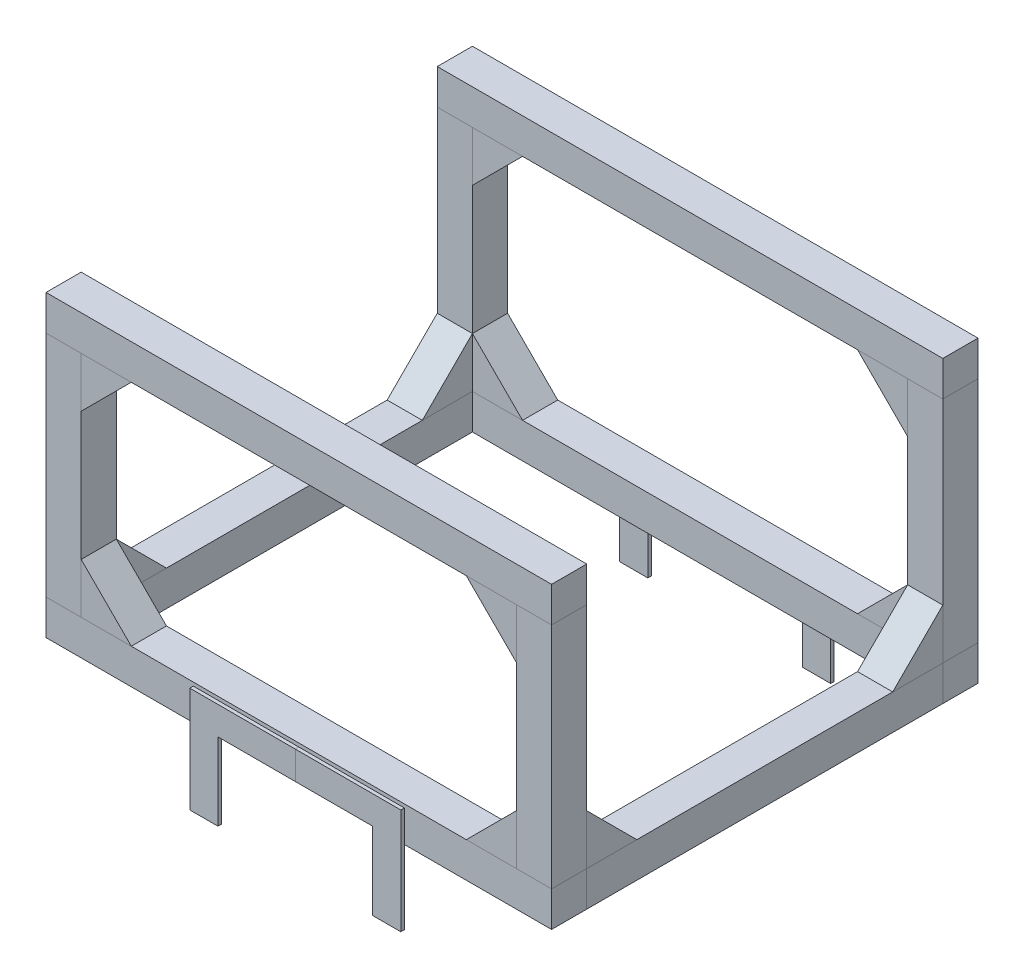
from build123d import *

# Parameters (mm, degrees)
SKETCH1_W             = 20
SKETCH1_H             = 20
BOSS_EXTRUDE1_DEPTH   = 101.25
BOSS_EXTRUDE1_2_DEPTH = 101.25
SKETCH2_W             = 20
SKETCH2_H             = 20
BOSS_EXTRUDE2_DEPTH   = 287.5
BOSS_EXTRUDE2_2_DEPTH = 287.5
SKETCH4_W             = 20
SKETCH4_H             = 20
BOSS_EXTRUDE3_DEPTH   = 130
BOSS_EXTRUDE3_2_DEPTH = 130
BOSS_EXTRUDE3_3_DEPTH = 130
BOSS_EXTRUDE3_4_DEPTH = 130
SKETCH5_W             = 20
SKETCH5_H             = 20
BOSS_EXTRUDE4_DEPTH   = 287.5
BOSS_EXTRUDE4_2_DEPTH = 287.5
BOSS_EXTRUDE5_DEPTH   = 20
BOSS_EXTRUDE5_2_DEPTH = 20
BOSS_EXTRUDE6_DEPTH   = 20
BOSS_EXTRUDE6_2_DEPTH = 20
BOSS_EXTRUDE7_DEPTH   = 20
BOSS_EXTRUDE7_2_DEPTH = 20
BOSS_EXTRUDE7_3_DEPTH = 20
BOSS_EXTRUDE7_4_DEPTH = 20
BOSS_EXTRUDE8_DEPTH   = 20
BOSS_EXTRUDE8_2_DEPTH = 20
BOSS_EXTRUDE8_3_DEPTH = 20
BOSS_EXTRUDE8_4_DEPTH = 20
BOSS_EXTRUDE9_DEPTH   = 2
BOSS_EXTRUDE10_DEPTH  = 2
BOSS_EXTRUDE11_DEPTH  = 2
BOSS_EXTRUDE12_DEPTH  = 2


with BuildPart() as part:
    # Sketch1 → Boss-Extrude1 (new, symmetric)
    with BuildSketch(Plane.XY):
        Rectangle(SKETCH1_W, SKETCH1_H)
    extrude(amount=BOSS_EXTRUDE1_DEPTH, both=True)


with BuildPart() as body_2:
    # Sketch1 → Boss-Extrude1 2 (new, symmetric)
    with BuildSketch(Plane.XY):
        with Locations((267.5, 0)):
            Rectangle(SKETCH1_W, SKETCH1_H)
    extrude(amount=BOSS_EXTRUDE1_2_DEPTH, both=True)


with BuildPart() as body_3:
    # Sketch2 → Boss-Extrude2 (new body)
    with BuildSketch(Plane.ZY.offset(10)):
        with Locations((111.25, 0)):
            Rectangle(SKETCH2_W, SKETCH2_H)
    extrude(amount=-BOSS_EXTRUDE2_DEPTH)


with BuildPart() as body_4:
    # Sketch2 → Boss-Extrude2 2 (new body)
    with BuildSketch(Plane.ZY.offset(10)):
        with Locations((-111.25, 0)):
            Rectangle(SKETCH2_W, SKETCH2_H)
    extrude(amount=-BOSS_EXTRUDE2_2_DEPTH)


with BuildPart() as body_5:
    # Sketch4 → Boss-Extrude3 (new body)
    with BuildSketch(Plane(origin=(0, 10, 0), x_dir=(1, 0, 0), z_dir=(0, 1, 0))):
        with Locations((0, 111.25)):
            Rectangle(SKETCH4_W, SKETCH4_H)
    extrude(amount=BOSS_EXTRUDE3_DEPTH)


with BuildPart() as body_6:
    # Sketch4 → Boss-Extrude3 2 (new body)
    with BuildSketch(Plane(origin=(0, 10, 0), x_dir=(1, 0, 0), z_dir=(0, 1, 0))):
        with Locations((0, -111.25)):
            Rectangle(SKETCH4_W, SKETCH4_H)
    extrude(amount=BOSS_EXTRUDE3_2_DEPTH)


with BuildPart() as body_7:
    # Sketch4 → Boss-Extrude3 3 (new body)
    with BuildSketch(Plane(origin=(0, 10, 0), x_dir=(1, 0, 0), z_dir=(0, 1, 0))):
        with Locations((267.5, -111.25)):
            Rectangle(SKETCH4_W, SKETCH4_H)
    extrude(amount=BOSS_EXTRUDE3_3_DEPTH)


with BuildPart() as body_8:
    # Sketch4 → Boss-Extrude3 4 (new body)
    with BuildSketch(Plane(origin=(0, 10, 0), x_dir=(1, 0, 0), z_dir=(0, 1, 0))):
        with Locations((267.5, 111.25)):
            Rectangle(SKETCH4_W, SKETCH4_H)
    extrude(amount=BOSS_EXTRUDE3_4_DEPTH)


with BuildPart() as body_9:
    # Sketch5 → Boss-Extrude4 (new body)
    with BuildSketch(Plane.ZY.offset(10)):
        with Locations((-111.25, 150)):
            Rectangle(SKETCH5_W, SKETCH5_H)
    extrude(amount=-BOSS_EXTRUDE4_DEPTH)


with BuildPart() as body_10:
    # Sketch5 → Boss-Extrude4 2 (new body)
    with BuildSketch(Plane.ZY.offset(10)):
        with Locations((111.25, 150)):
            Rectangle(SKETCH5_W, SKETCH5_H)
    extrude(amount=-BOSS_EXTRUDE4_2_DEPTH)


with BuildPart() as body_11:
    # Sketch6 → Boss-Extrude5 (new body)
    with BuildSketch(Plane(origin=(277.5, 0, 0), x_dir=(0, 0, -1), z_dir=(1, 0, 0))):
        Polygon((-101.25, 10), (-72.75, 10), (-101.25, 38.5), align=None)
    extrude(amount=-BOSS_EXTRUDE5_DEPTH)


with BuildPart() as body_12:
    # Sketch6 → Boss-Extrude5 2 (new body)
    with BuildSketch(Plane(origin=(277.5, 0, 0), x_dir=(0, 0, -1), z_dir=(1, 0, 0))):
        Polygon((101.25, 10), (72.75, 10), (101.25, 38.5), align=None)
    extrude(amount=-BOSS_EXTRUDE5_2_DEPTH)


with BuildPart() as body_13:
    # Sketch7 → Boss-Extrude6 (new body)
    with BuildSketch(Plane.ZY.offset(10)):
        Polygon((-101.25, 10), (-101.25, 38.5), (-72.75, 10), align=None)
    extrude(amount=-BOSS_EXTRUDE6_DEPTH)


with BuildPart() as body_14:
    # Sketch7 → Boss-Extrude6 2 (new body)
    with BuildSketch(Plane.ZY.offset(10)):
        Polygon((101.25, 10), (101.25, 38.5), (72.75, 10), align=None)
    extrude(amount=-BOSS_EXTRUDE6_2_DEPTH)


with BuildPart() as body_15:
    # Sketch8 → Boss-Extrude7 (new body)
    with BuildSketch(Plane.XY.offset(121.25)):
        Polygon((10, 10), (10, 38.5), (38.5, 10), align=None)
    extrude(amount=-BOSS_EXTRUDE7_DEPTH)


with BuildPart() as body_16:
    # Sketch8 → Boss-Extrude7 2 (new body)
    with BuildSketch(Plane.XY.offset(121.25)):
        Polygon((10, 140), (10, 111.5), (38.5, 140), align=None)
    extrude(amount=-BOSS_EXTRUDE7_2_DEPTH)


with BuildPart() as body_17:
    # Sketch8 → Boss-Extrude7 3 (new body)
    with BuildSketch(Plane.XY.offset(121.25)):
        Polygon((257.5, 140), (257.5, 111.5), (229, 140), align=None)
    extrude(amount=-BOSS_EXTRUDE7_3_DEPTH)


with BuildPart() as body_18:
    # Sketch8 → Boss-Extrude7 4 (new body)
    with BuildSketch(Plane.XY.offset(121.25)):
        Polygon((257.5, 10), (257.5, 38.5), (229, 10), align=None)
    extrude(amount=-BOSS_EXTRUDE7_4_DEPTH)


with BuildPart() as body_19:
    # Sketch9 → Boss-Extrude8 (new body)
    with BuildSketch(Plane(origin=(0, 0, -121.25), x_dir=(-1, 0, 0), z_dir=(0, 0, -1))):
        Polygon((-229, 10), (-257.5, 10), (-257.5, 38.5), align=None)
    extrude(amount=-BOSS_EXTRUDE8_DEPTH)


with BuildPart() as body_20:
    # Sketch9 → Boss-Extrude8 2 (new body)
    with BuildSketch(Plane(origin=(0, 0, -121.25), x_dir=(-1, 0, 0), z_dir=(0, 0, -1))):
        Polygon((-38.5, 10), (-10, 10), (-10, 38.5), align=None)
    extrude(amount=-BOSS_EXTRUDE8_2_DEPTH)


with BuildPart() as body_21:
    # Sketch9 → Boss-Extrude8 3 (new body)
    with BuildSketch(Plane(origin=(0, 0, -121.25), x_dir=(-1, 0, 0), z_dir=(0, 0, -1))):
        Polygon((-10, 140), (-10, 111.5), (-38.5, 140), align=None)
    extrude(amount=-BOSS_EXTRUDE8_3_DEPTH)


with BuildPart() as body_22:
    # Sketch9 → Boss-Extrude8 4 (new body)
    with BuildSketch(Plane(origin=(0, 0, -121.25), x_dir=(-1, 0, 0), z_dir=(0, 0, -1))):
        Polygon((-229, 140), (-257.5, 140), (-257.5, 111.5), align=None)
    extrude(amount=-BOSS_EXTRUDE8_4_DEPTH)


with BuildPart() as body_23:
    # Sketch10 → Boss-Extrude9 (new body)
    with BuildSketch(Plane(origin=(0, 0, -121.25), x_dir=(-1, 0, 0), z_dir=(0, 0, -1))):
        Polygon((-133.75, 8), (-133.75, -8), (-89.75, -8), (-89.75, -52), (-73.75, -52), (-73.75, 8), align=None)
    extrude(amount=BOSS_EXTRUDE9_DEPTH)


with BuildPart() as body_24:
    # Sketch11 → Boss-Extrude10 (new body)
    with BuildSketch(Plane(origin=(0, 0, -121.25), x_dir=(-1, 0, 0), z_dir=(0, 0, -1))):
        Polygon((-193.75, 8), (-133.75, 8), (-133.75, -8), (-177.75, -8), (-177.75, -52), (-193.75, -52), align=None)
    extrude(amount=BOSS_EXTRUDE10_DEPTH)


with BuildPart() as body_25:
    # Sketch12 → Boss-Extrude11 (new body)
    with BuildSketch(Plane.XY.offset(121.25)):
        Polygon((133.75, 8), (133.75, -8), (177.75, -8), (177.75, -52), (193.75, -52), (193.75, 8), align=None)
    extrude(amount=BOSS_EXTRUDE11_DEPTH)


with BuildPart() as body_26:
    # Sketch13 → Boss-Extrude12 (new body)
    with BuildSketch(Plane.XY.offset(121.25)):
        Polygon((73.75, 8), (73.75, -52), (89.75, -52), (89.75, -8), (133.75, -8), (133.75, 8), align=None)
    extrude(amount=BOSS_EXTRUDE12_DEPTH)


solid = Compound([part.part, body_2.part, body_3.part, body_4.part, body_5.part, body_6.part, body_7.part, body_8.part, body_9.part, body_10.part, body_11.part, body_12.part, body_13.part, body_14.part, body_15.part, body_16.part, body_17.part, body_18.part, body_19.part, body_20.part, body_21.part, body_22.part, body_23.part, body_24.part, body_25.part, body_26.part])
